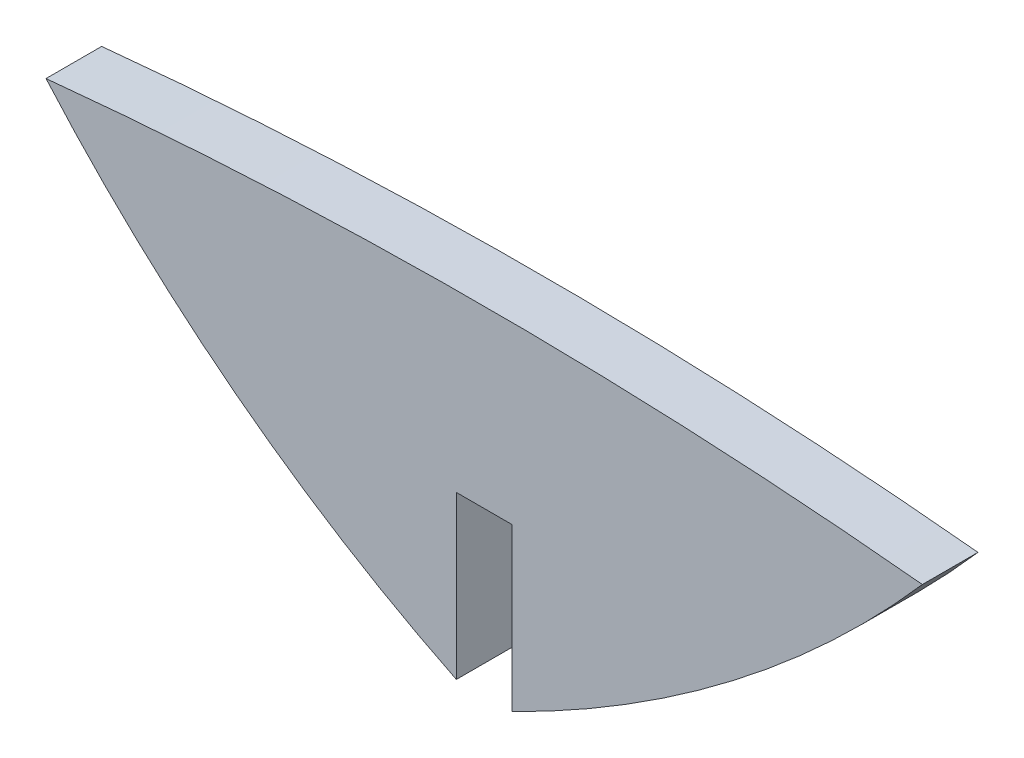
from build123d import *

# Parameters (mm, degrees)
BOSS_EXTRUDE1_DEPTH = 1.5875


with BuildPart() as part:
    # Sketch2 → Boss-Extrude1 (new, symmetric)
    with BuildSketch(Plane.XY.offset(1.5875)):
        with BuildLine():
            ThreePointArc((-25, 356.408412891), (-14.187505021, 346.252036042), (-1.5875, 338.422482296))
            Line((-1.5875, 338.422482296), (-1.5875, 347.664977579))
            ThreePointArc((-1.5875, 347.664977579), (0, 349.252477579), (1.5875, 347.664977579))
            Line((1.5875, 347.664977579), (1.5875, 338.422482296))
            ThreePointArc((1.5875, 338.422482296), (14.187505021, 346.252036042), (25, 356.408412891))
            ThreePointArc((25, 356.408412891), (0, 357.65994376), (-25, 356.408412891))
        make_face()
        with BuildLine():
            Line((-1.5875, 347.664977579), (1.5875, 347.664977579))
            ThreePointArc((1.5875, 347.664977579), (0, 349.252477579), (-1.5875, 347.664977579))
        make_face()
    extrude(amount=BOSS_EXTRUDE1_DEPTH, both=True)


solid = part.part
